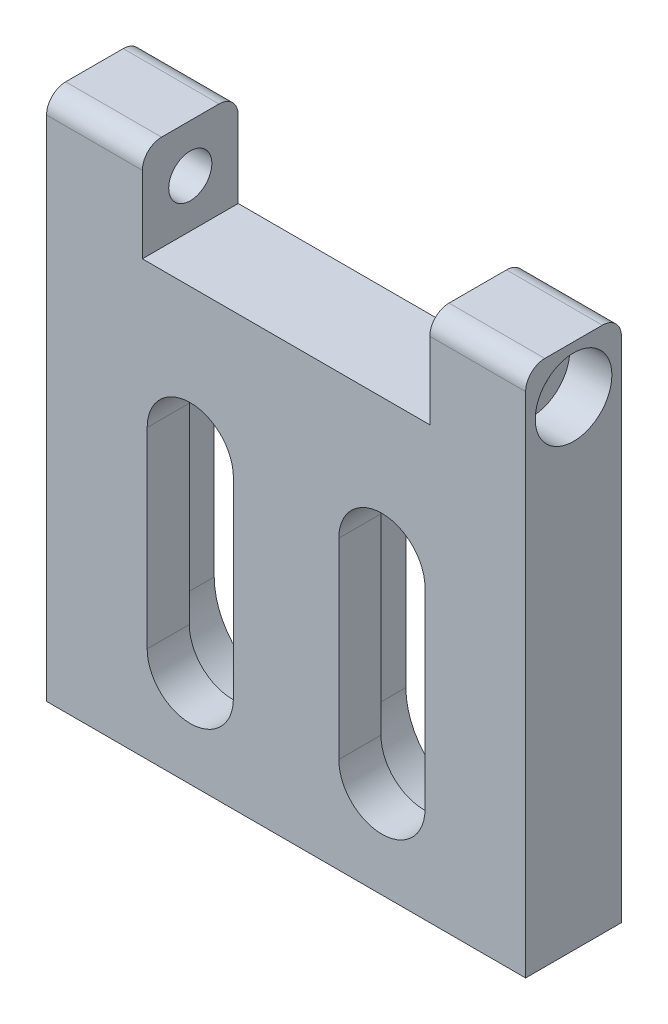
from build123d import *

# Parameters (mm, degrees)
SKETCH1_W           = 50
SKETCH1_H           = 55
BOSS_EXTRUDE3_DEPTH = 10
SKETCH2_W           = 30
SKETCH2_H           = 10
CUT_EXTRUDE2_DEPTH  = 10
CUT_EXTRUDE3_DEPTH  = 5.6
FILLET1_R           = 2


with BuildPart() as part:
    # Sketch1 → Boss-Extrude3 (new body)
    with BuildSketch(Plane.XY):
        Rectangle(SKETCH1_W, SKETCH1_H)
        with BuildLine():
            Line((-5.5, 2.5), (-5.5, -17.5))
            ThreePointArc((-5.5, -17.5), (-10, -22), (-14.5, -17.5))
            Line((-14.5, -17.5), (-14.5, 2.5))
            ThreePointArc((-14.5, 2.5), (-10, 7), (-5.5, 2.5))
        make_face(mode=Mode.SUBTRACT)
        with BuildLine():
            Line((5.5, 2.5), (5.5, -17.5))
            ThreePointArc((5.5, -17.5), (10, -22), (14.5, -17.5))
            Line((14.5, -17.5), (14.5, 2.5))
            ThreePointArc((14.5, 2.5), (10, 7), (5.5, 2.5))
        make_face(mode=Mode.SUBTRACT)
    extrude(amount=BOSS_EXTRUDE3_DEPTH)

    # Sketch2 → Cut-Extrude2 (cut)
    with BuildSketch(Plane(origin=(0, 0, 0), x_dir=(-1, 0, 0), z_dir=(0, 0, -1))):
        with Locations((0, 22.5)):
            Rectangle(SKETCH2_W, SKETCH2_H)
    extrude(amount=-CUT_EXTRUDE2_DEPTH, mode=Mode.SUBTRACT)

    # Sketch6 → CBORE for M4 Hex Socket Head Cap Screw1 (revolve, cut)
    with BuildSketch(Plane(origin=(25, 22.5, 5), x_dir=(0, 0, -1), z_dir=(0, 1, 0))):
        Polygon((0, 0), (0, 15.351936393), (2.25, 14), (2.25, 4.4), (4, 4.4), (4, 0), align=None)
    cbore_for_m4_hex_socket_head_cap_screw1 = revolve(axis=Axis((31.35, 22.5, 5), (-1, 0, 0)), mode=Mode.SUBTRACT)

    # Mirror1: CBORE for M4 Hex Socket Head Cap Screw1 across plane
    add(cbore_for_m4_hex_socket_head_cap_screw1.mirror(Plane(origin=(0, 0, 0), x_dir=(0, 0, 1), z_dir=(1, 0, 0))), mode=Mode.SUBTRACT)

    # Sketch7 → Cut-Extrude3 (cut)
    with BuildSketch(Plane(origin=(0, 0, 0), x_dir=(-1, 0, 0), z_dir=(0, 0, -1))):
        with BuildLine():
            Line((-2.5, 2.5), (-2.5, -17.5))
            ThreePointArc((-2.5, -17.5), (-10, -25), (-17.5, -17.5))
            Line((-17.5, -17.5), (-17.5, 2.5))
            ThreePointArc((-17.5, 2.5), (-10, 10), (-2.5, 2.5))
        make_face()
        with BuildLine():
            Line((2.5, 2.5), (2.5, -17.5))
            ThreePointArc((2.5, -17.5), (10, -25), (17.5, -17.5))
            Line((17.5, -17.5), (17.5, 2.5))
            ThreePointArc((17.5, 2.5), (10, 10), (2.5, 2.5))
        make_face()
    extrude(amount=-CUT_EXTRUDE3_DEPTH, mode=Mode.SUBTRACT)

    # Fillet1
    fillet1_edges = [part.edges().sort_by_distance(p)[0] for p in [
        (-20, 27.5, 0),
        (-20, 27.5, 10),
        (20, 27.5, 0),
        (20, 27.5, 10),
    ]]
    fillet(fillet1_edges, radius=FILLET1_R)


solid = part.part
